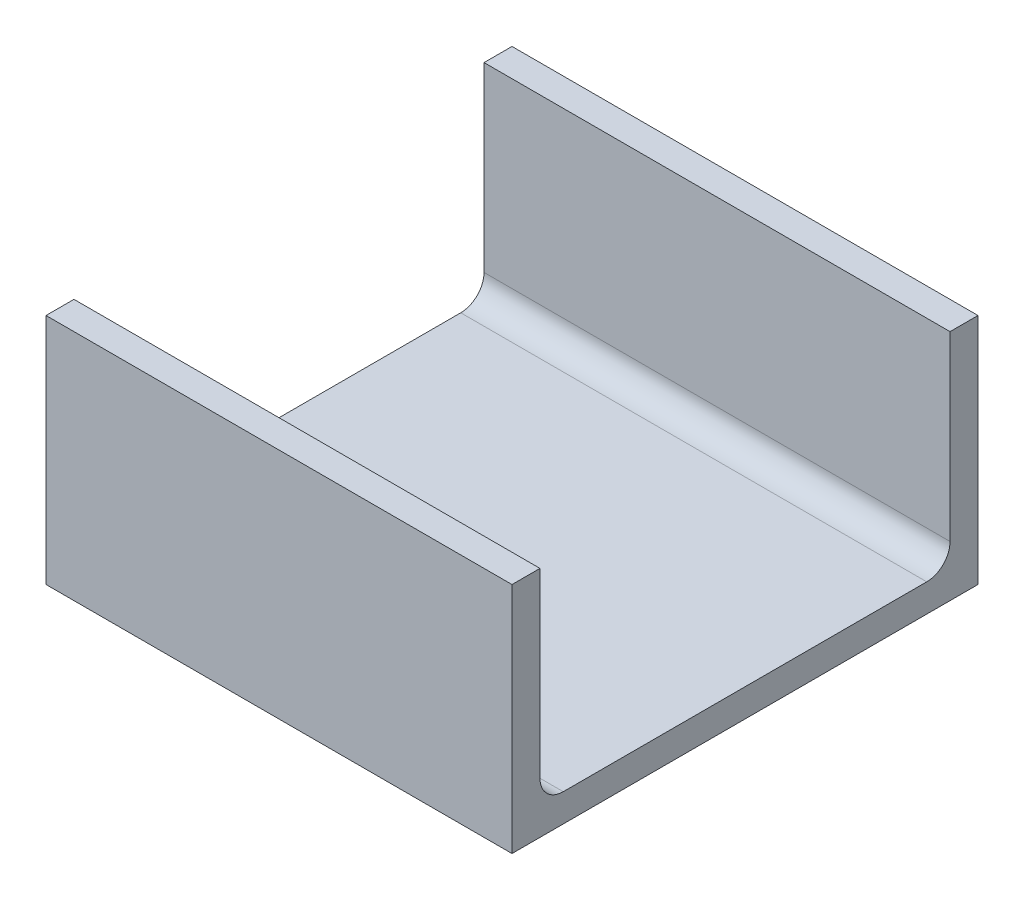
from build123d import *

# Parameters (mm, degrees)
BOSS_EXTRUDE1_DEPTH = 50.8


with BuildPart() as part:
    # Sketch1 → Boss-Extrude1 (new body)
    with BuildSketch(Plane(origin=(0, 0, 0), x_dir=(0, 0, -1), z_dir=(1, 0, 0))):
        with BuildLine():
            Line((-22.352, -7.112), (-22.352, 9.652))
            Line((-22.352, 9.652), (-22.352, 12.7))
            Line((-22.352, 12.7), (-25.4, 12.7))
            Line((-25.4, 12.7), (-25.4, -12.7))
            Line((-25.4, -12.7), (25.4, -12.7))
            Line((25.4, -12.7), (25.4, 12.7))
            Line((25.4, 12.7), (22.352, 12.7))
            Line((22.352, 12.7), (22.352, 9.652))
            Line((22.352, 9.652), (22.352, -7.112))
            ThreePointArc((22.352, -7.112), (21.608051224, -8.908051224), (19.812, -9.652))
            Line((19.812, -9.652), (-19.812, -9.652))
            ThreePointArc((-19.812, -9.652), (-21.608051224, -8.908051224), (-22.352, -7.112))
        make_face()
    extrude(amount=BOSS_EXTRUDE1_DEPTH)


solid = part.part
